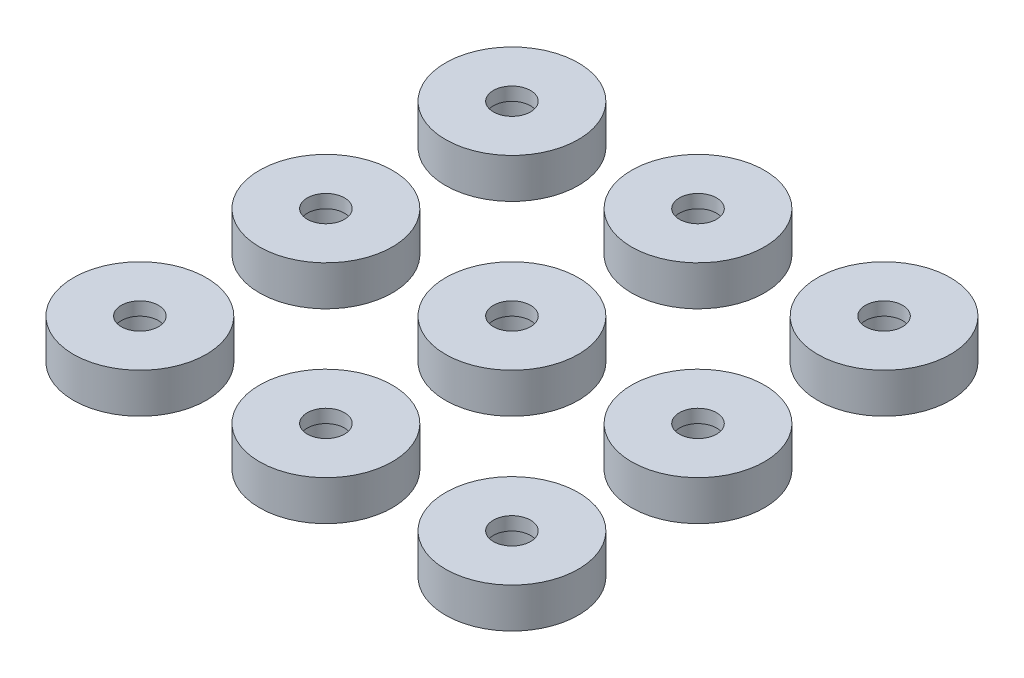
from build123d import *

# Parameters (mm, degrees)
SKETCH_1_R             = 2.5
EXTRUDE_1_DEPTH        = 1.5
SKETCH_1_5_R           = 1
CUT_EXTRUDE_2_DEPTH    = 1
SKETCH_1_6_R           = 0.7
CUT_EXTRUDE_3_DEPTH    = 4.840572874
PATTERN_LINEAR_1_COUNT = 3
PATTERN_LINEAR_1_PITCH = 7
PATTERN_LINEAR_2_COUNT = 3
PATTERN_LINEAR_2_PITCH = 7


with BuildPart() as part:
    # 草图1 → 凸台-拉伸1 (new body)
    with BuildSketch(Plane(origin=(0, 0, 0), x_dir=(1, 0, 0), z_dir=(0, 1, 0))):
        Circle(SKETCH_1_R)
    extrude(amount=EXTRUDE_1_DEPTH)

    # 草图1<5> → 切除-拉伸2 (cut)
    with BuildSketch(Plane(origin=(0, 0, 0), x_dir=(1, 0, 0), z_dir=(0, 1, 0))):
        Circle(SKETCH_1_5_R)
    extrude(amount=CUT_EXTRUDE_2_DEPTH, mode=Mode.SUBTRACT)

    # 草图1<6> → 切除-拉伸3 (cut, through all)
    with BuildSketch(Plane(origin=(0, 0, 0), x_dir=(1, 0, 0), z_dir=(0, 1, 0))):
        Circle(SKETCH_1_6_R)
    extrude(amount=CUT_EXTRUDE_3_DEPTH, mode=Mode.SUBTRACT)


with BuildPart() as pattern_linear_1_1:
    # 阵列(线性)1: pattern copy
    add(part.part.moved(Location(Vector(0, 0, 1) * (1 * PATTERN_LINEAR_1_PITCH))))


with BuildPart() as pattern_linear_1_2:
    # 阵列(线性)1: pattern copy
    add(part.part.moved(Location(Vector(0, 0, 1) * (2 * PATTERN_LINEAR_1_PITCH))))


with BuildPart() as pattern_linear_2_1:
    # 阵列(线性)2: pattern copy
    add(part.part.moved(Location(Vector(1, 0, 0) * (1 * PATTERN_LINEAR_2_PITCH))))


with BuildPart() as pattern_linear_2_2:
    # 阵列(线性)2: pattern copy
    add(part.part.moved(Location(Vector(1, 0, 0) * (2 * PATTERN_LINEAR_2_PITCH))))


with BuildPart() as pattern_linear_2_3:
    # 阵列(线性)2: pattern copy
    add(pattern_linear_1_1.part.moved(Location(Vector(1, 0, 0) * (1 * PATTERN_LINEAR_2_PITCH))))


with BuildPart() as pattern_linear_2_4:
    # 阵列(线性)2: pattern copy
    add(pattern_linear_1_1.part.moved(Location(Vector(1, 0, 0) * (2 * PATTERN_LINEAR_2_PITCH))))


with BuildPart() as pattern_linear_2_5:
    # 阵列(线性)2: pattern copy
    add(pattern_linear_1_2.part.moved(Location(Vector(1, 0, 0) * (1 * PATTERN_LINEAR_2_PITCH))))


with BuildPart() as pattern_linear_2_6:
    # 阵列(线性)2: pattern copy
    add(pattern_linear_1_2.part.moved(Location(Vector(1, 0, 0) * (2 * PATTERN_LINEAR_2_PITCH))))


solid = Compound([part.part, pattern_linear_1_1.part, pattern_linear_1_2.part, pattern_linear_2_1.part, pattern_linear_2_2.part, pattern_linear_2_3.part, pattern_linear_2_4.part, pattern_linear_2_5.part, pattern_linear_2_6.part])
